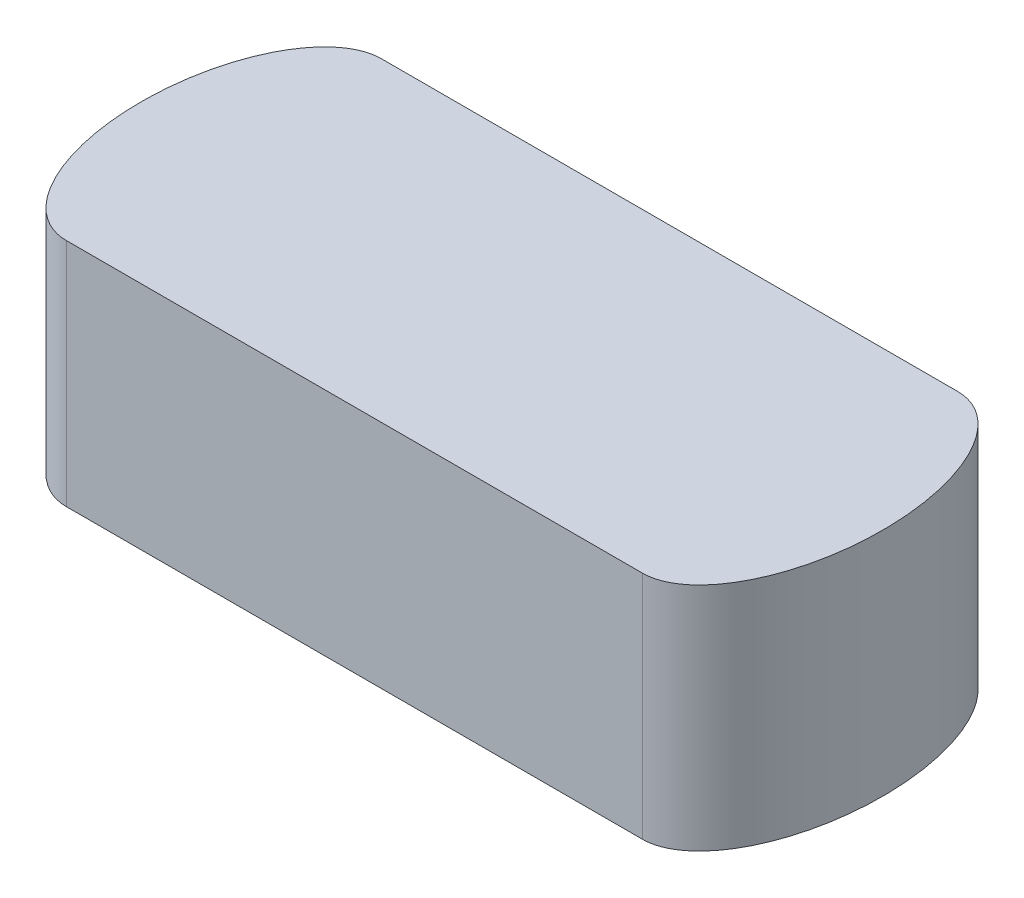
from build123d import *

# Parameters (mm, degrees)
BOSS_EXTRUDE1_DEPTH = 200


with BuildPart() as part:
    # Sketch1 → Boss-Extrude1 (new body)
    with BuildSketch(Plane(origin=(0, 0, 0), x_dir=(1, 0, 0), z_dir=(0, 1, 0))):
        with BuildLine():
            Line((-250, 136.655948553), (0, 136.655948553))
            Line((0, 136.655948553), (0, -136.655948553))
            Line((0, -136.655948553), (-250, -136.655948553))
            add(Edge.make_bspline(
                [(-250, 136.655948553), (-321.859586268, 136.655948553), (-321.859586268, 0), (-321.859586268, -136.655948553), (-250, -136.655948553)],
                knots=[3.141592654, 3.141592654, 3.141592654, 4.71238898, 4.71238898, 6.283185307, 6.283185307, 6.283185307], degree=2, weights=[1, 0.707106781, 1, 0.707106781, 1]))
        make_face()
    boss_extrude1 = extrude(amount=BOSS_EXTRUDE1_DEPTH)

    # Mirror1: Boss-Extrude1 across plane
    add(boss_extrude1.mirror(Plane(origin=(0, 200, -136.655948553), x_dir=(0, 0, 1), z_dir=(-1, 0, 0))))


solid = part.part
